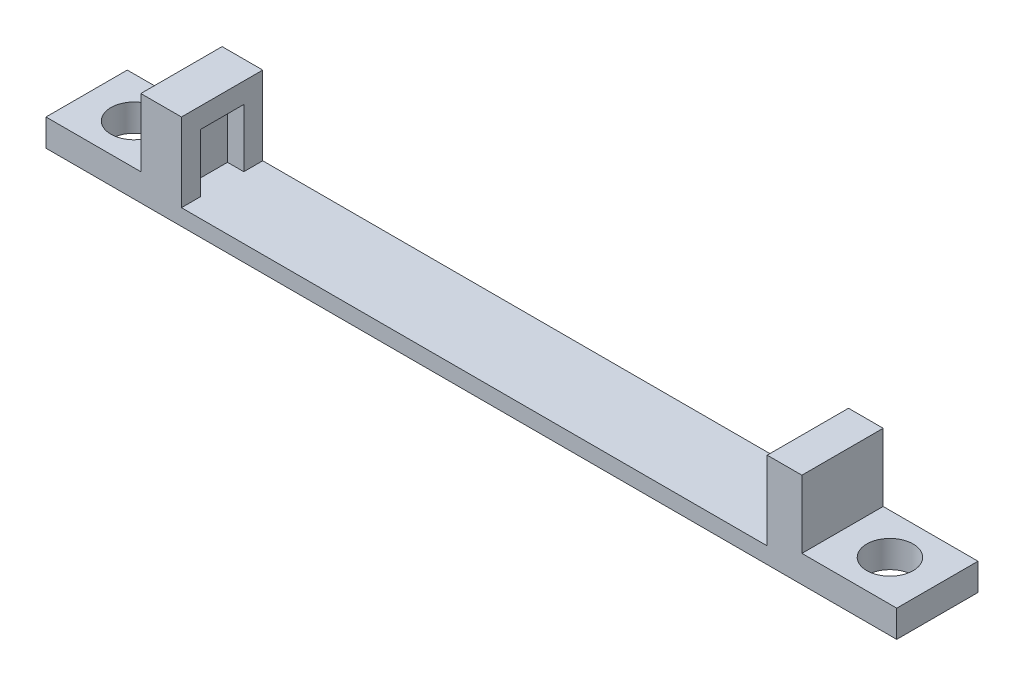
from build123d import *

# Parameters (mm, degrees)
SKETCH1_W           = 79.756
SKETCH1_H           = 7.62
BOSS_EXTRUDE1_DEPTH = 8.89
SKETCH2_W           = 8.89
SKETCH2_H           = 7.62
CUT_EXTRUDE1_DEPTH  = 6.35
SKETCH3_W           = 8.89
SKETCH3_H           = 7.62
CUT_EXTRUDE2_DEPTH  = 6.35
SKETCH4_W           = 54.9148
SKETCH4_H           = 7.62
CUT_EXTRUDE3_DEPTH  = 7.366
SKETCH5_W           = 4.064
SKETCH5_H           = 5.461
CUT_EXTRUDE4_DEPTH  = 1.524
SKETCH7_W           = 3.683
SKETCH7_H           = 4.445
BOSS_EXTRUDE2_DEPTH = 1.524
SKETCH8_R           = 2.1717
CUT_EXTRUDE5_DEPTH  = 2.54
SKETCH9_R           = 2.1717
CUT_EXTRUDE6_DEPTH  = 2.54


with BuildPart() as part:
    # Sketch1 → Boss-Extrude1 (new body)
    with BuildSketch(Plane(origin=(0, 0, 0), x_dir=(1, 0, 0), z_dir=(0, 1, 0))):
        with Locations((25.937163647, -9.682646588)):
            Rectangle(SKETCH1_W, SKETCH1_H)
    extrude(amount=BOSS_EXTRUDE1_DEPTH)

    # Sketch2 → Cut-Extrude1 (cut)
    with BuildSketch(Plane(origin=(0, 8.89, 0), x_dir=(1, 0, 0), z_dir=(0, 1, 0))):
        with Locations((-9.495836353, -9.682646588)):
            Rectangle(SKETCH2_W, SKETCH2_H)
    extrude(amount=-CUT_EXTRUDE1_DEPTH, mode=Mode.SUBTRACT)

    # Sketch3 → Cut-Extrude2 (cut)
    with BuildSketch(Plane(origin=(0, 8.89, 0), x_dir=(1, 0, 0), z_dir=(0, 1, 0))):
        with Locations((61.370163647, -9.682646588)):
            Rectangle(SKETCH3_W, SKETCH3_H)
    extrude(amount=-CUT_EXTRUDE2_DEPTH, mode=Mode.SUBTRACT)

    # Sketch4 → Cut-Extrude3 (cut)
    with BuildSketch(Plane(origin=(0, 8.89, 0), x_dir=(1, 0, 0), z_dir=(0, 1, 0))):
        with Locations((26.216563647, -9.682646588)):
            Rectangle(SKETCH4_W, SKETCH4_H)
    extrude(amount=-CUT_EXTRUDE3_DEPTH, mode=Mode.SUBTRACT)

    # Sketch5 → Cut-Extrude4 (cut)
    with BuildSketch(Plane(origin=(-1.240836353, 0, 0), x_dir=(0, 0, -1), z_dir=(1, 0, 0))):
        with Locations((-9.682646588, 4.2545)):
            Rectangle(SKETCH5_W, SKETCH5_H)
    extrude(amount=-CUT_EXTRUDE4_DEPTH, mode=Mode.SUBTRACT)

    # Sketch7 → Boss-Extrude2 (add)
    with BuildSketch(Plane.ZY.offset(-53.673963647)):
        with Locations((9.682646588, 4.7625)):
            Rectangle(SKETCH7_W, SKETCH7_H)
    extrude(amount=BOSS_EXTRUDE2_DEPTH)

    # Sketch8 → Cut-Extrude5 (cut)
    with BuildSketch(Plane(origin=(0, 2.54, 0), x_dir=(1, 0, 0), z_dir=(0, 1, 0))):
        with Locations(Location((-9.495836353, -9.682646588, 0), (0, 0, 270))):
            Circle(SKETCH8_R)
    extrude(amount=-CUT_EXTRUDE5_DEPTH, mode=Mode.SUBTRACT)

    # Sketch9 → Cut-Extrude6 (cut)
    with BuildSketch(Plane(origin=(0, 2.54, 0), x_dir=(1, 0, 0), z_dir=(0, 1, 0))):
        with Locations(Location((61.370163647, -9.682646588, 0), (0, 0, 270))):
            Circle(SKETCH9_R)
    extrude(amount=-CUT_EXTRUDE6_DEPTH, mode=Mode.SUBTRACT)


solid = part.part
